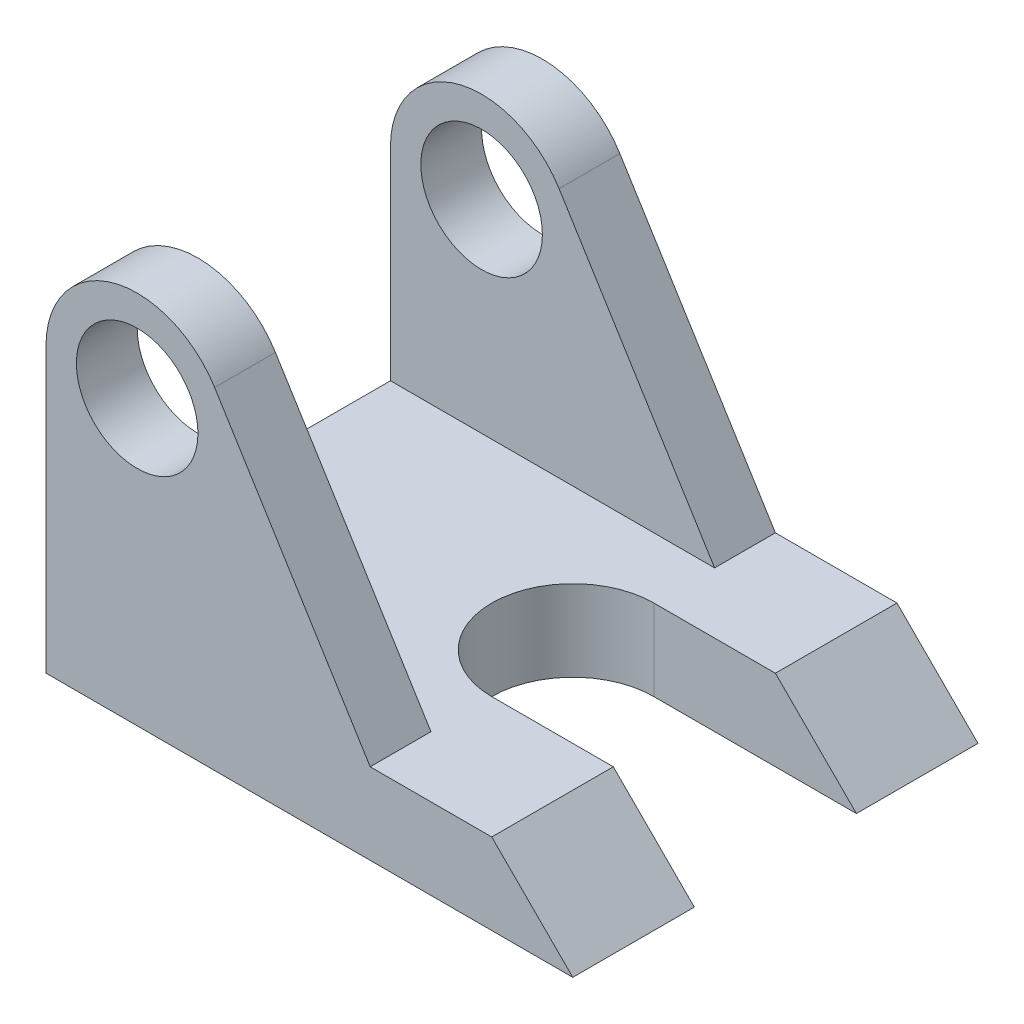
from build123d import *

# Parameters (mm, degrees)
BOSS_EXTRUDE1_DEPTH    = 50
SKETCH2_W              = 148.779959867
SKETCH2_H              = 70
CUT_EXTRUDE1_DEPTH     = 158.023087474
CUT_EXTRUDE2_DEPTH     = 158.023087474
F_20_0MM_DOWEL_HOLE1_D = 30


with BuildPart() as part:
    # Sketch1 → Boss-Extrude1 (new, symmetric)
    with BuildSketch(Plane.XY):
        with BuildLine():
            Line((0, 0), (130, 0))
            Line((130, 0), (110, 20))
            Line((110, 20), (80, 20))
            Line((80, 20), (41.61915802, 81.862031723))
            ThreePointArc((41.61915802, 81.862031723), (16.33279056, 91.638288466), (0, 70))
            Line((0, 70), (0, 0))
        make_face()
    extrude(amount=BOSS_EXTRUDE1_DEPTH, both=True)

    # Sketch2 → Cut-Extrude1 (cut, through all)
    with BuildSketch(Plane(origin=(0, 20, 0), x_dir=(1, 0, 0), z_dir=(0, 1, 0))):
        with Locations((64.376441805, 0)):
            Rectangle(SKETCH2_W, SKETCH2_H)
    extrude(amount=CUT_EXTRUDE1_DEPTH, mode=Mode.SUBTRACT)

    # Sketch3 → Cut-Extrude2 (cut, through all)
    with BuildSketch(Plane(origin=(0, 20, 0), x_dir=(1, 0, 0), z_dir=(0, 1, 0))):
        with BuildLine():
            Line((80, 20), (132.067444877, 20))
            Line((132.067444877, 20), (132.067444877, -20))
            Line((132.067444877, -20), (80, -20))
            ThreePointArc((80, -20), (60, 0), (80, 20))
        make_face()
    extrude(amount=-CUT_EXTRUDE2_DEPTH, mode=Mode.SUBTRACT)

    # Ø20.0mm Dowel Hole1 (through all)
    with Locations(Plane.XY.offset(50)):
        with Locations((22.5, 70)):
            Hole(F_20_0MM_DOWEL_HOLE1_D / 2)


solid = part.part
